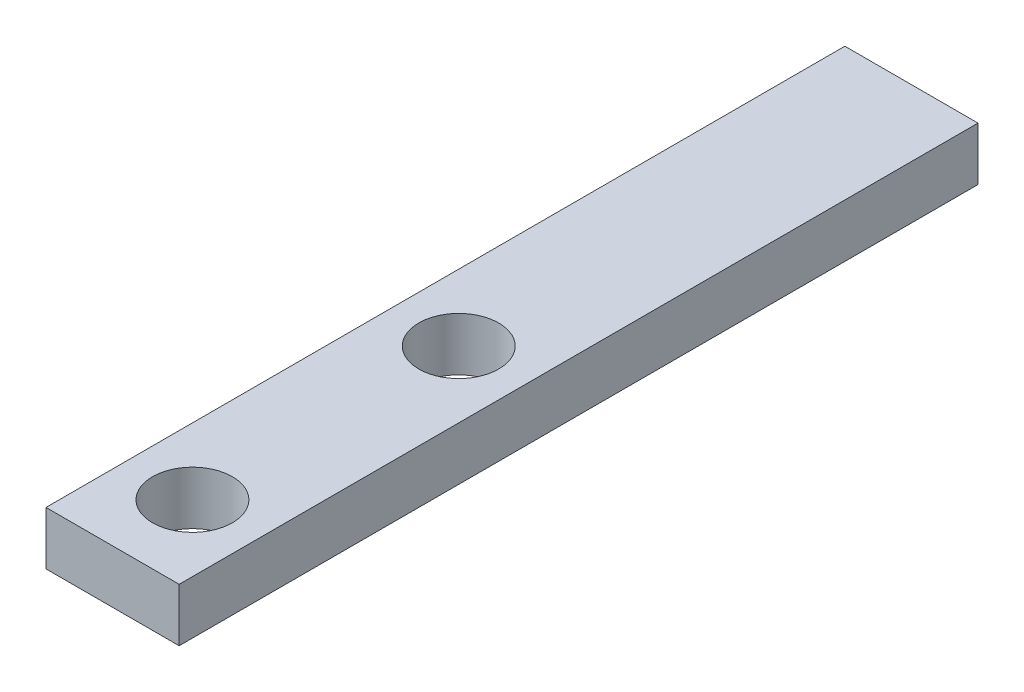
from build123d import *

# Parameters (mm, degrees)
SKETCH1_W           = 5
SKETCH1_H           = 30
SKETCH1_R           = 1.5
BOSS_EXTRUDE1_DEPTH = 2


with BuildPart() as part:
    # Sketch1 → Boss-Extrude1 (new body)
    with BuildSketch(Plane(origin=(0, 0, 0), x_dir=(1, 0, 0), z_dir=(0, 1, 0))):
        Rectangle(SKETCH1_W, SKETCH1_H)
        with Locations(Location((0, -12, 0), (0, 0, 270))):
            Circle(SKETCH1_R, mode=Mode.SUBTRACT)
        with Locations(Location((0, -2, 0), (0, 0, 270))):
            Circle(SKETCH1_R, mode=Mode.SUBTRACT)
    extrude(amount=BOSS_EXTRUDE1_DEPTH)


solid = part.part
